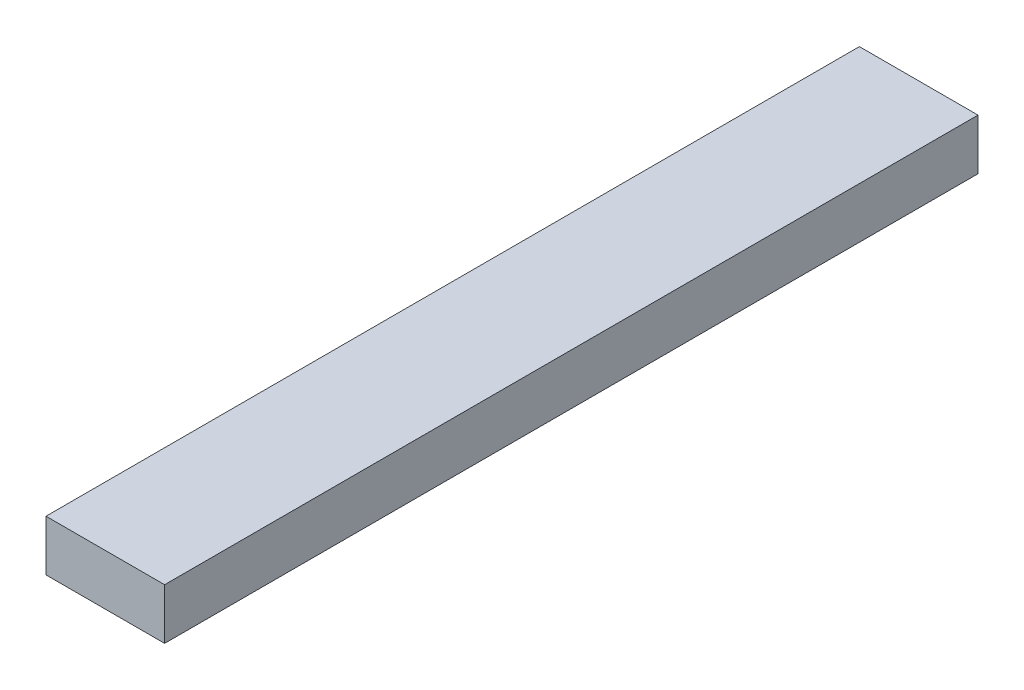
from build123d import *

# Parameters (mm, degrees)
SKETCH1_W           = 88.9
SKETCH1_H           = 38.1
BOSS_EXTRUDE1_DEPTH = 304.8


with BuildPart() as part:
    # Sketch1 → Boss-Extrude1 (new, symmetric)
    with BuildSketch(Plane.XY):
        Rectangle(SKETCH1_W, SKETCH1_H)
    extrude(amount=BOSS_EXTRUDE1_DEPTH, both=True)


solid = part.part
